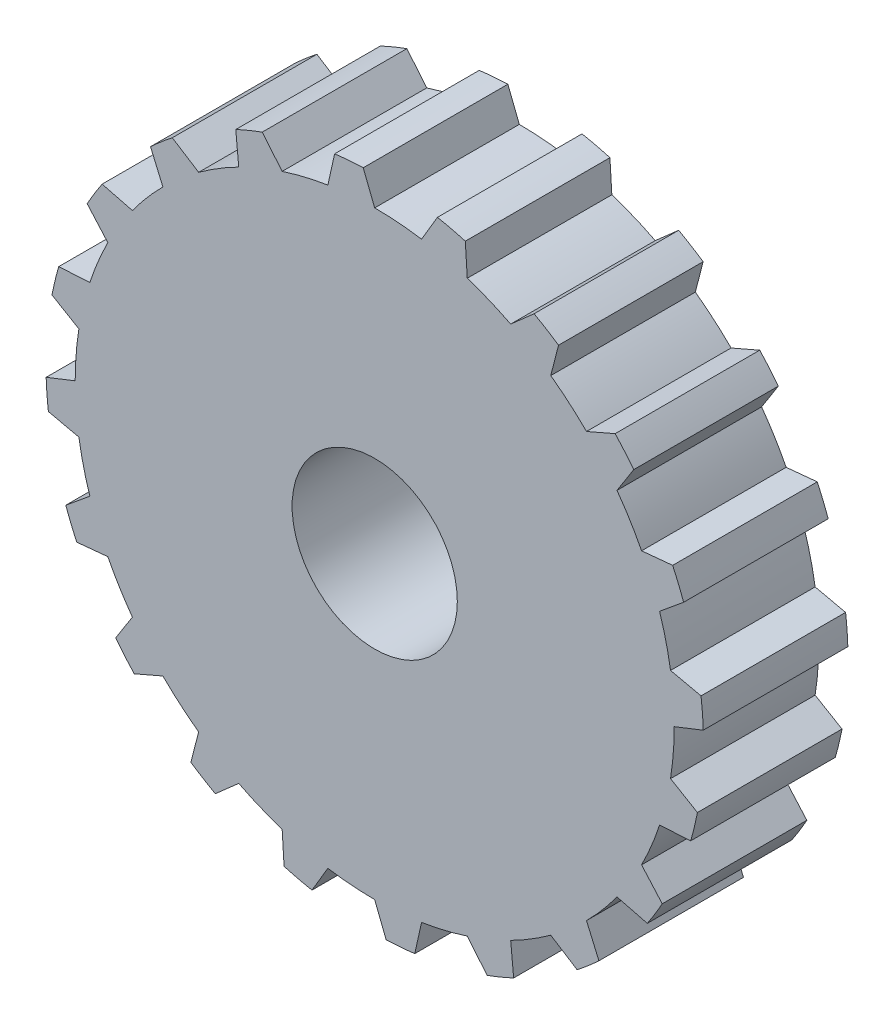
from build123d import *

# Parameters (mm, degrees)
SKETCH1_R           = 4
BOSS_EXTRUDE1_DEPTH = 7


with BuildPart() as part:
    # Sketch1 → Boss-Extrude1 (new body)
    with BuildSketch(Plane.XY.offset(7)):
        with BuildLine():
            Line((16.296858351, 1.939610316), (14.821480939, 2.268299743))
            ThreePointArc((14.821480939, 2.268299743), (14.599363846, 3.384957776), (14.290319486, 4.480746418))
            Line((14.290319486, 4.480746418), (15.455668509, 5.443418171))
            ThreePointArc((15.455668509, 5.443418171), (15.203995461, 6.090594341), (14.924332522, 6.726176719))
            Line((14.924332522, 6.726176719), (13.419594601, 6.582862246))
            ThreePointArc((13.419594601, 6.582862246), (12.863282383, 7.576229188), (12.230746418, 8.522886158))
            Line((12.230746418, 8.522886158), (13.041577269, 9.798554054))
            ThreePointArc((13.041577269, 9.798554054), (12.602233541, 10.336283919), (12.139852525, 10.85433808))
            Line((12.139852525, 10.85433808), (10.753048327, 10.253048327))
            ThreePointArc((10.753048327, 10.253048327), (9.916996701, 11.025886501), (9.022886158, 11.730746418))
            Line((9.022886158, 11.730746418), (9.399829063, 13.194539196))
            ThreePointArc((9.399829063, 13.194539196), (8.815820682, 13.570186009), (8.215982663, 13.920001203))
            Line((8.215982663, 13.920001203), (7.082862246, 12.919594601))
            ThreePointArc((7.082862246, 12.919594601), (6.048909769, 13.396253221), (4.980746418, 13.790319486))
            Line((4.980746418, 13.790319486), (4.88690358, 15.298950909))
            ThreePointArc((4.88690358, 15.298950909), (4.215397354, 15.475743744), (3.536818658, 15.623077622))
            Line((3.536818658, 15.623077622), (2.768299743, 14.321480939))
            ThreePointArc((2.768299743, 14.321480939), (1.637656888, 14.455301339), (0.5, 14.5))
            Line((0.5, 14.5), (-0.055442591, 15.905794714))
            ThreePointArc((-0.055442591, 15.905794714), (-0.748714953, 15.866427856), (-1.439610316, 15.796858351))
            Line((-1.439610316, 15.796858351), (-1.768299743, 14.321480939))
            ThreePointArc((-1.768299743, 14.321480939), (-2.884957776, 14.099363846), (-3.980746418, 13.790319486))
            Line((-3.980746418, 13.790319486), (-4.943418171, 14.955668509))
            ThreePointArc((-4.943418171, 14.955668509), (-5.590594341, 14.703995461), (-6.226176719, 14.424332522))
            Line((-6.226176719, 14.424332522), (-6.082862246, 12.919594601))
            ThreePointArc((-6.082862246, 12.919594601), (-7.076229188, 12.363282383), (-8.022886158, 11.730746418))
            Line((-8.022886158, 11.730746418), (-9.298554054, 12.541577269))
            ThreePointArc((-9.298554054, 12.541577269), (-9.836283919, 12.102233541), (-10.35433808, 11.639852525))
            Line((-10.35433808, 11.639852525), (-9.753048327, 10.253048327))
            ThreePointArc((-9.753048327, 10.253048327), (-10.525886501, 9.416996701), (-11.230746418, 8.522886158))
            Line((-11.230746418, 8.522886158), (-12.694539196, 8.899829063))
            ThreePointArc((-12.694539196, 8.899829063), (-13.070186009, 8.315820682), (-13.420001203, 7.715982663))
            Line((-13.420001203, 7.715982663), (-12.419594601, 6.582862246))
            ThreePointArc((-12.419594601, 6.582862246), (-12.896253221, 5.548909769), (-13.290319486, 4.480746418))
            Line((-13.290319486, 4.480746418), (-14.798950909, 4.38690358))
            ThreePointArc((-14.798950909, 4.38690358), (-14.975743744, 3.715397354), (-15.123077622, 3.036818658))
            Line((-15.123077622, 3.036818658), (-13.821480939, 2.268299743))
            ThreePointArc((-13.821480939, 2.268299743), (-13.955301339, 1.137656888), (-14, 0))
            Line((-14, 0), (-15.405794714, -0.555442591))
            ThreePointArc((-15.405794714, -0.555442591), (-15.366427856, -1.248714953), (-15.296858351, -1.939610316))
            Line((-15.296858351, -1.939610316), (-13.821480939, -2.268299743))
            ThreePointArc((-13.821480939, -2.268299743), (-13.599363846, -3.384957776), (-13.290319486, -4.480746418))
            Line((-13.290319486, -4.480746418), (-14.455668509, -5.443418171))
            ThreePointArc((-14.455668509, -5.443418171), (-14.203995461, -6.090594341), (-13.924332522, -6.726176719))
            Line((-13.924332522, -6.726176719), (-12.419594601, -6.582862246))
            ThreePointArc((-12.419594601, -6.582862246), (-11.863282383, -7.576229188), (-11.230746418, -8.522886158))
            Line((-11.230746418, -8.522886158), (-12.041577269, -9.798554054))
            ThreePointArc((-12.041577269, -9.798554054), (-11.602233541, -10.336283919), (-11.139852525, -10.85433808))
            Line((-11.139852525, -10.85433808), (-9.753048327, -10.253048327))
            ThreePointArc((-9.753048327, -10.253048327), (-8.916996701, -11.025886501), (-8.022886158, -11.730746418))
            Line((-8.022886158, -11.730746418), (-8.399829063, -13.194539196))
            ThreePointArc((-8.399829063, -13.194539196), (-7.815820682, -13.570186009), (-7.215982663, -13.920001203))
            Line((-7.215982663, -13.920001203), (-6.082862246, -12.919594601))
            ThreePointArc((-6.082862246, -12.919594601), (-5.048909769, -13.396253221), (-3.980746418, -13.790319486))
            Line((-3.980746418, -13.790319486), (-3.88690358, -15.298950909))
            ThreePointArc((-3.88690358, -15.298950909), (-3.215397354, -15.475743744), (-2.536818658, -15.623077622))
            Line((-2.536818658, -15.623077622), (-1.768299743, -14.321480939))
            ThreePointArc((-1.768299743, -14.321480939), (-0.637656888, -14.455301339), (0.5, -14.5))
            Line((0.5, -14.5), (1.055442591, -15.905794714))
            ThreePointArc((1.055442591, -15.905794714), (1.748714953, -15.866427856), (2.439610316, -15.796858351))
            Line((2.439610316, -15.796858351), (2.768299743, -14.321480939))
            ThreePointArc((2.768299743, -14.321480939), (3.884957776, -14.099363846), (4.980746418, -13.790319486))
            Line((4.980746418, -13.790319486), (5.943418171, -14.955668509))
            ThreePointArc((5.943418171, -14.955668509), (6.590594341, -14.703995461), (7.226176719, -14.424332522))
            Line((7.226176719, -14.424332522), (7.082862246, -12.919594601))
            ThreePointArc((7.082862246, -12.919594601), (8.076229188, -12.363282383), (9.022886158, -11.730746418))
            Line((9.022886158, -11.730746418), (10.298554054, -12.541577269))
            ThreePointArc((10.298554054, -12.541577269), (10.836283919, -12.102233541), (11.35433808, -11.639852525))
            Line((11.35433808, -11.639852525), (10.753048327, -10.253048327))
            ThreePointArc((10.753048327, -10.253048327), (11.525886501, -9.416996701), (12.230746418, -8.522886158))
            Line((12.230746418, -8.522886158), (13.694539196, -8.899829063))
            ThreePointArc((13.694539196, -8.899829063), (14.070186009, -8.315820682), (14.420001203, -7.715982663))
            Line((14.420001203, -7.715982663), (13.419594601, -6.582862246))
            ThreePointArc((13.419594601, -6.582862246), (13.896253221, -5.548909769), (14.290319486, -4.480746418))
            Line((14.290319486, -4.480746418), (15.798950909, -4.38690358))
            ThreePointArc((15.798950909, -4.38690358), (15.975743744, -3.715397354), (16.123077622, -3.036818658))
            Line((16.123077622, -3.036818658), (14.821480939, -2.268299743))
            ThreePointArc((14.821480939, -2.268299743), (14.955301339, -1.137656888), (15, 0))
            Line((15, 0), (16.405794714, 0.555442591))
            ThreePointArc((16.405794714, 0.555442591), (16.366427856, 1.248714953), (16.296858351, 1.939610316))
        make_face()
        with Locations((0.5, 0)):
            Circle(SKETCH1_R, mode=Mode.SUBTRACT)
    extrude(amount=-BOSS_EXTRUDE1_DEPTH)


solid = part.part
